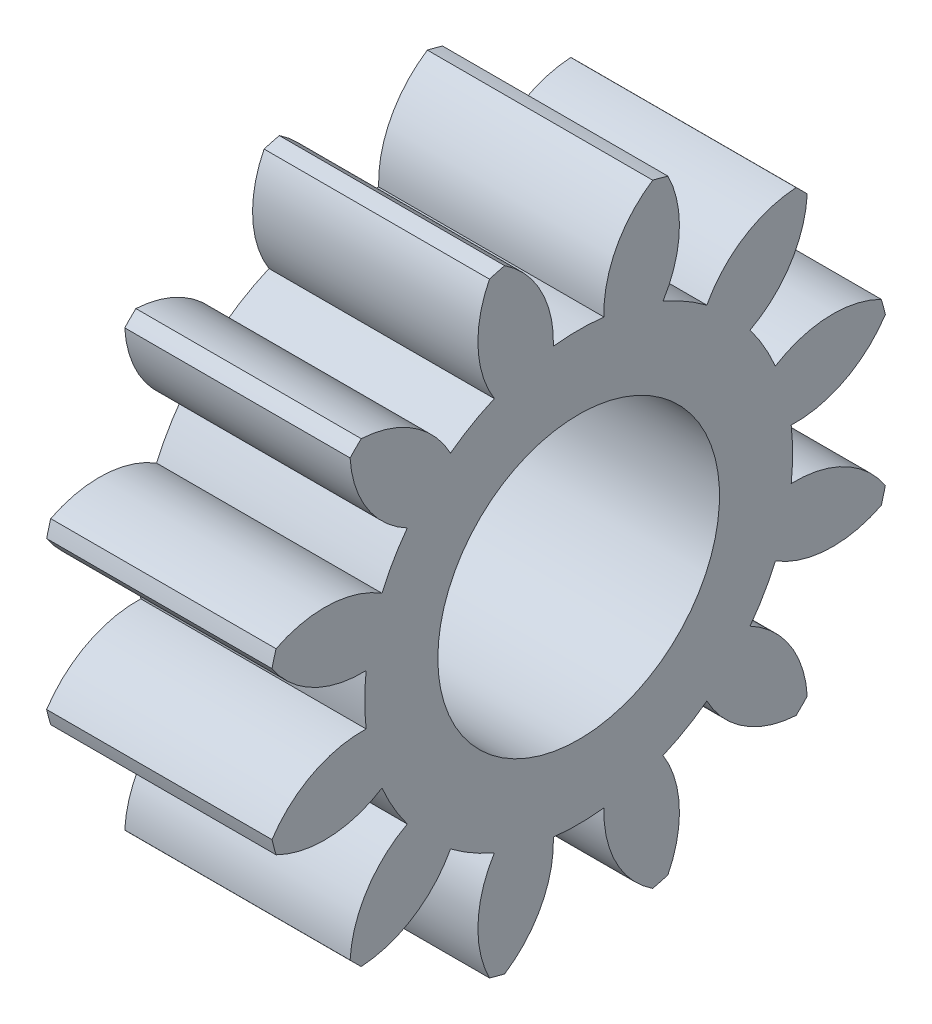
from build123d import *

# Parameters (mm, degrees)
BASPROSKE_W     = 4
BASPROSKE_H     = 5.6
TOOTHCUT_DEPTH  = 9.872429205
TEETHCUTS_COUNT = 12
TEETHCUTS_ANGLE = 330
BORSKE_R        = 2.5
BORE_DEPTH      = 50.0000508


with BuildPart() as part:
    # BasProSke → Base-Revolve (revolve)
    with BuildSketch(Plane(origin=(0, 0, 0), x_dir=(1, 0, 0), z_dir=(0, 1, 0)), mode=Mode.PRIVATE) as base_revolve_sk:
        with Locations((2, 2.8)):
            Rectangle(BASPROSKE_W, BASPROSKE_H)
    revolve(base_revolve_sk.sketch.rotate(Axis((-10, 0, 0), (1, 0, 0)), 180), axis=Axis((-10, 0, 0), (1, 0, 0)))

    # TooCutSke → ToothCut (cut, through all)
    with BuildSketch(Plane(origin=(0, 0, 0), x_dir=(0, 0, -1), z_dir=(1, 0, 0))):
        with BuildLine():
            ThreePointArc((0.449218713, 3.77234722), (0, 3.799), (-0.449218713, 3.77234722))
            ThreePointArc((-0.449218713, 3.77234722), (-0.670924606, 4.73673149), (-1.343429094, 5.462629717))
            ThreePointArc((-1.343429094, 5.462629717), (0, 5.6254), (1.343429094, 5.462629717))
            ThreePointArc((1.343429094, 5.462629717), (0.670924606, 4.73673149), (0.449218713, 3.77234722))
        make_face()
    toothcut = extrude(amount=TOOTHCUT_DEPTH, mode=Mode.SUBTRACT)

    # TeethCuts: ToothCut ×12 about axis
    teethcuts_axis = Axis((-10, 0, 0), (1, 0, 0))
    for i in range(1, TEETHCUTS_COUNT):
        add(toothcut.rotate(teethcuts_axis, i * TEETHCUTS_ANGLE / (TEETHCUTS_COUNT - 1)), mode=Mode.SUBTRACT)

    # BorSke → Bore (cut, symmetric)
    with BuildSketch(Plane(origin=(0, 0, 0), x_dir=(0, 0, -1), z_dir=(1, 0, 0))):
        with Locations(Location((0, 0, 0), (0, 0, 180))):
            Circle(BORSKE_R)
    extrude(amount=BORE_DEPTH, both=True, mode=Mode.SUBTRACT)


solid = part.part
